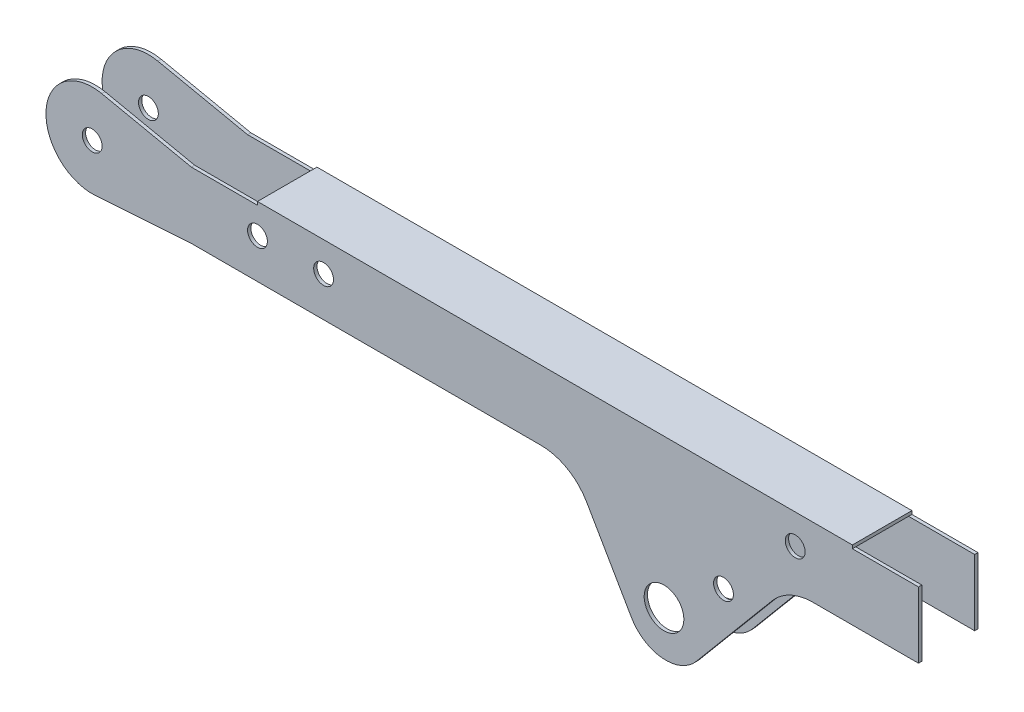
from build123d import *

# Parameters (mm, degrees)
SKETCH_1_R      = 1.5
SKETCH_1_R_2    = 3
EXTRUDE_1_DEPTH = 0.5
SKETCH_3_R      = 1.5
SKETCH_3_R_2    = 3
EXTRUDE_2_DEPTH = 0.5
SKETCH_4_W      = 90
SKETCH_4_H      = 9
EXTRUDE_3_DEPTH = 0.5
FILLET_1_R      = 8
FILLET_2_R      = 6


with BuildPart() as part:
    # 草图1 → 凸台-拉伸1 (new body)
    with BuildSketch(Plane.XY):
        with BuildLine():
            Line((-28.937588447, 11.863865809), (81.062411553, 11.863865809))
            Line((81.062411553, 11.863865809), (81.062411553, 1.863865809))
            Line((81.062411553, 1.863865809), (61.338833841, 1.863865809))
            Line((61.338833841, 1.863865809), (41.922203683, -21.275972939))
            Line((41.922203683, -21.275972939), (28.562411553, 1.863865809))
            Line((28.562411553, 1.863865809), (-28.937588447, 1.863865809))
            Line((-28.937588447, 1.863865809), (-43.464520366, 0.879869346))
            ThreePointArc((-43.464520366, 0.879869346), (-50.920555651, 8.351891461), (-42.497668866, 14.714167379))
            Line((-42.497668866, 14.714167379), (-28.937588447, 11.863865809))
        make_face()
        with Locations((-43.937588447, 7.863865809)):
            Circle(SKETCH_1_R, mode=Mode.SUBTRACT)
        with Locations((42.562411553, -10.136134191)):
            Circle(SKETCH_1_R_2, mode=Mode.SUBTRACT)
        with Locations((51.562411553, -3.136134191)):
            Circle(SKETCH_1_R, mode=Mode.SUBTRACT)
        with Locations((-18.937588447, 7.863865809)):
            Circle(SKETCH_1_R, mode=Mode.SUBTRACT)
        with Locations((-8.937588447, 7.863865809)):
            Circle(SKETCH_1_R, mode=Mode.SUBTRACT)
        with Locations((62.409410938, 7.863865809)):
            Circle(SKETCH_1_R, mode=Mode.SUBTRACT)
    extrude(amount=EXTRUDE_1_DEPTH)



with BuildPart() as body_2:
    # 草图3 → 凸台-拉伸2 (new body)
    with BuildSketch(Plane.XY.offset(-8)):
        with BuildLine():
            Line((41.922203683, -21.275972939), (61.338833841, 1.863865809))
            Line((61.338833841, 1.863865809), (81.062411553, 1.863865809))
            Line((81.062411553, 1.863865809), (81.062411553, 11.863865809))
            Line((81.062411553, 11.863865809), (-28.937588447, 11.863865809))
            Line((-28.937588447, 11.863865809), (-42.497668866, 14.714167379))
            ThreePointArc((-42.497668866, 14.714167379), (-50.920555651, 8.351891461), (-43.464520366, 0.879869346))
            Line((-43.464520366, 0.879869346), (-28.937588447, 1.863865809))
            Line((-28.937588447, 1.863865809), (28.562411553, 1.863865809))
            Line((28.562411553, 1.863865809), (41.922203683, -21.275972939))
        make_face()
        with Locations((51.562411553, -3.136134191)):
            Circle(SKETCH_3_R, mode=Mode.SUBTRACT)
        with Locations((42.562411553, -10.136134191)):
            Circle(SKETCH_3_R_2, mode=Mode.SUBTRACT)
        with Locations((-43.937588447, 7.863865809)):
            Circle(SKETCH_3_R, mode=Mode.SUBTRACT)
        with Locations((62.409410938, 7.863865809)):
            Circle(SKETCH_3_R, mode=Mode.SUBTRACT)
        with Locations((-8.937588447, 7.863865809)):
            Circle(SKETCH_3_R, mode=Mode.SUBTRACT)
        with Locations((-18.937588447, 7.863865809)):
            Circle(SKETCH_3_R, mode=Mode.SUBTRACT)
    extrude(amount=-EXTRUDE_2_DEPTH)


with BuildPart() as part_1:
    add(part.part)

    add(body_2.part)  # 凸台-拉伸3 merges body 2
    # 草图4 → 凸台-拉伸3 (add)
    with BuildSketch(Plane(origin=(0, 11.863865809, 0), x_dir=(1, 0, 0), z_dir=(0, 1, 0))):
        with Locations((26.062411553, 4)):
            Rectangle(SKETCH_4_W, SKETCH_4_H)
    extrude(amount=EXTRUDE_3_DEPTH)

    # 圆角1
    fillet_1_edges = [part_1.edges().sort_by_distance(p)[0] for p in [
        (61.338833841, 1.863865809, 0.25),
        (28.562411553, 1.863865809, 0.25),
        (28.562411553, 1.863865809, -8.25),
        (61.338833841, 1.863865809, -8.25),
    ]]
    fillet(fillet_1_edges, radius=FILLET_1_R)

    # 圆角2
    fillet_2_edges = [part_1.edges().sort_by_distance(p)[0] for p in [
        (41.922203683, -21.275972939, 0.25),
        (41.922203683, -21.275972939, -8.25),
    ]]
    fillet(fillet_2_edges, radius=FILLET_2_R)


solid = part_1.part
